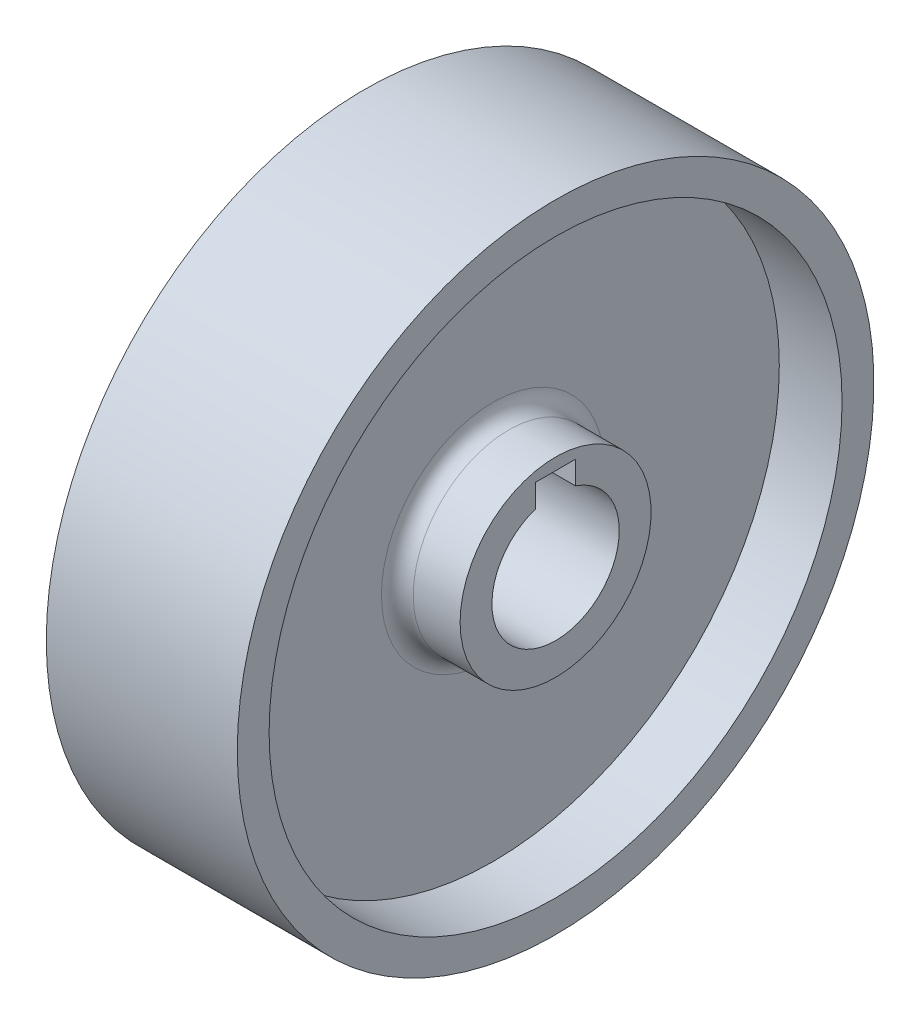
from build123d import *

# Parameters (mm, degrees)
SKETCH2_W          = 5
SKETCH2_H          = 4.464495409
CUT_EXTRUDE1_DEPTH = 82.228385508
FILLET1_R          = 2
FILLET2_R          = 2


with BuildPart() as part:
    # Sketch1 → Revolve1 (revolve)
    with BuildSketch(Plane.XY, mode=Mode.PRIVATE) as revolve1_sk:
        Polygon((-12.114285714, 13.542857143), (11.885714286, 13.542857143), (11.885714286, 9.542857143), (4, 9.542857143), (4, -14.457142857), (11.885714286, -14.457142857), (11.885714286, -18.457142857), (-12.114285714, -18.457142857), (-12.114285714, -14.457142857), (-4, -14.457142857), (-4, 9.542857143), (-12.114285714, 9.542857143), (-12.114285714, 12.742857143), align=None)
    revolve(revolve1_sk.sketch.rotate(Axis((-20.457142857, -26.457142857, 0), (1, 0, 0)), 90), axis=Axis((-20.457142857, -26.457142857, 0), (1, 0, 0)))

    # Sketch2 → Cut-Extrude1 (cut, through all)
    with BuildSketch(Plane(origin=(12, 0, 0), x_dir=(0, 0, -1), z_dir=(1, 0, 0))):
        with Locations((0, -18.189390562)):
            Rectangle(SKETCH2_W, SKETCH2_H)
    extrude(amount=-CUT_EXTRUDE1_DEPTH, mode=Mode.SUBTRACT)

    # Fillet1
    fillet1_edges = [part.edges().sort_by_distance(p)[0] for p in [
        (4, -26.457142857, -12),
    ]]
    fillet(fillet1_edges, radius=FILLET1_R)

    # Fillet2
    fillet2_edges = [part.edges().sort_by_distance(p)[0] for p in [
        (-4, -26.457142857, -12),
    ]]
    fillet(fillet2_edges, radius=FILLET2_R)


solid = part.part
